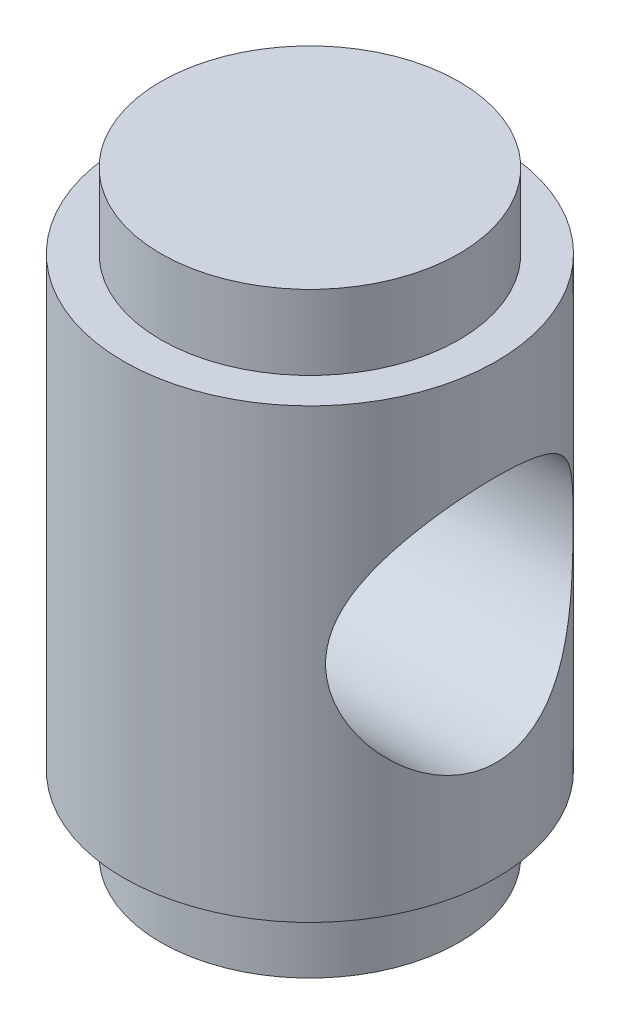
from build123d import *

# Parameters (mm, degrees)
SKETCH3_W              = 16.6
SKETCH3_H              = 25
F_25_0MM_DOWEL_HOLE2_D = 33.2


with BuildPart() as part:
    # Sketch1 → Revolve1 (revolve)
    with BuildSketch(Plane.XY, mode=Mode.PRIVATE) as revolve1_sk:
        Polygon((20, -30), (20, -40), (0, -40), (0, 40), (20, 40), (20, 30), (25, 30), (25, -30), align=None)
    revolve(revolve1_sk.sketch.rotate(Axis((0, 40, 0), (0, -1, 0)), 90), axis=Axis((0, 40, 0), (0, -1, 0)))

    # Sketch3 → Ø1.0mm Dowel Hole1 (revolve, cut)
    with BuildSketch(Plane.ZX):
        with Locations((8.3, 12.5)):
            Rectangle(SKETCH3_W, SKETCH3_H)
    revolve(axis=Axis((-6.35, 0, 0), (1, 0, 0)), mode=Mode.SUBTRACT)

    # Ø25.0mm Dowel Hole2 (through all)
    with Locations(Plane(origin=(0, 0, 0), x_dir=(0, 0, -1), z_dir=(1, 0, 0))):
        with Locations((0, 0)):
            Hole(F_25_0MM_DOWEL_HOLE2_D / 2)


solid = part.part
